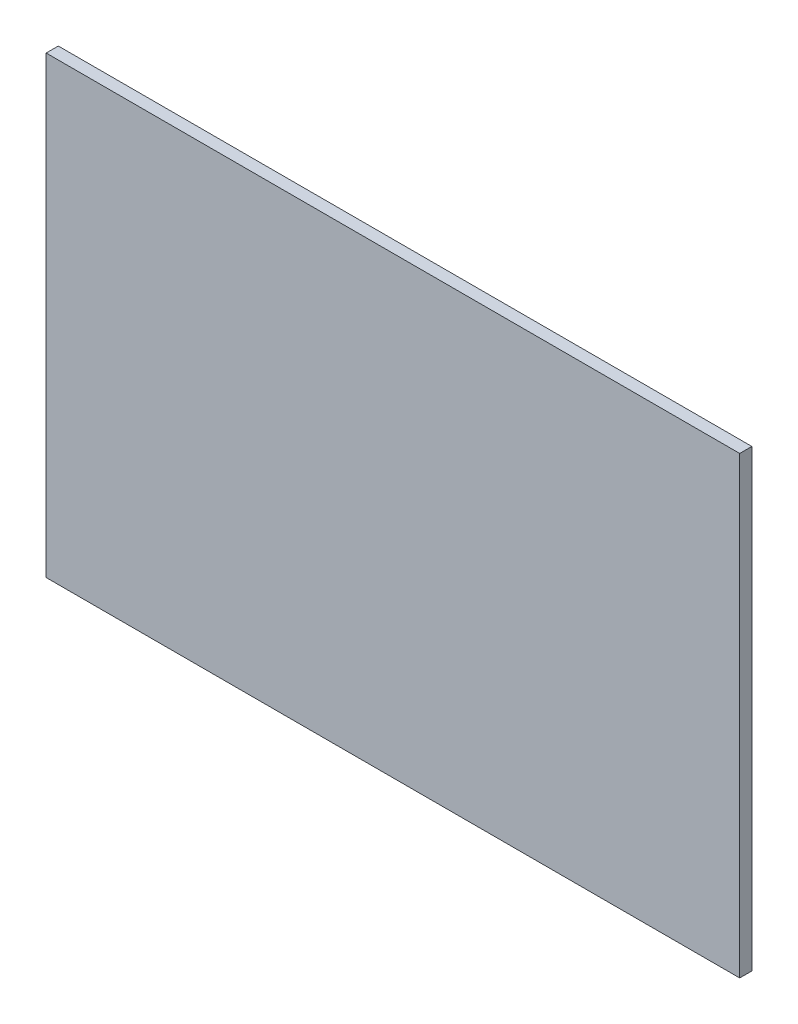
from build123d import *

# Parameters (mm, degrees)
SKETCH1_W           = 145.034
SKETCH1_H           = 94.996
BOSS_EXTRUDE1_DEPTH = 2.54


with BuildPart() as part:
    # Sketch1 → Boss-Extrude1 (new body)
    with BuildSketch(Plane.XY):
        with Locations((-11.169952381, -11.535228571)):
            Rectangle(SKETCH1_W, SKETCH1_H)
    extrude(amount=-BOSS_EXTRUDE1_DEPTH)


solid = part.part
